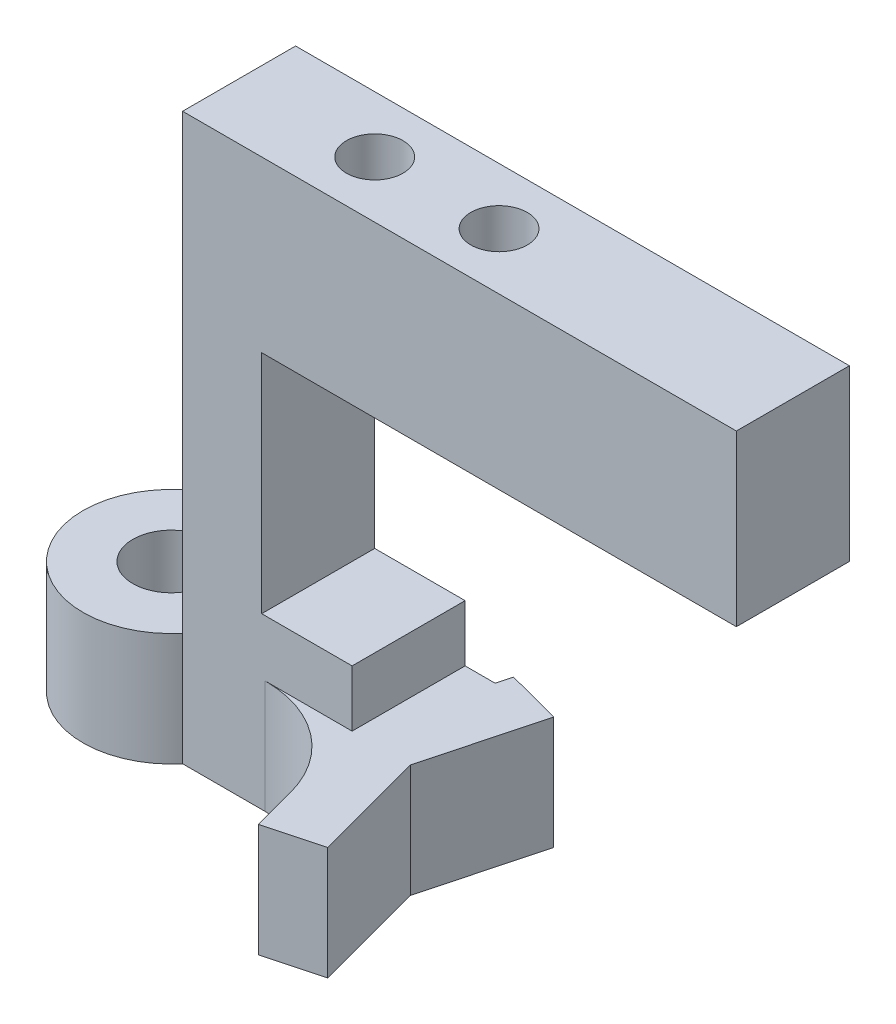
from build123d import *

# Parameters (mm, degrees)
BOSS_EXTRUDE1_DEPTH = 5
BOSS_EXTRUDE2_DEPTH = 10
FILLET1_R           = 10
SKETCH3_W           = 8
SKETCH3_H           = 20
CUT_EXTRUDE1_DEPTH  = 74.171272574
SKETCH4_R           = 2.5
CUT_EXTRUDE2_DEPTH  = 63.379394923
SKETCH5_R           = 3.4
BOSS_EXTRUDE4_DEPTH = 10


with BuildPart() as part:
    # Sketch1 → Boss-Extrude1 (new, symmetric)
    with BuildSketch(Plane.XY):
        Polygon((49, 0), (0, 0), (0, -50), (15, -50), (15, -15), (49, -15), align=None)
    extrude(amount=BOSS_EXTRUDE1_DEPTH, both=True)

    # Sketch2 → Boss-Extrude2 (add)
    with BuildSketch(Plane.XZ.offset(50)):
        Polygon((22.832157544, -5), (18, -6.284621916), (15, 5), (18, 16.284621916), (22.832157544, 15), (20.173672375, 5), align=None)
        Polygon((15, -5), (17.658485169, -5), (15, 5), align=None)
        Polygon((18, 16.284621916), (15, 5), (20.173672375, 5), (22.832157544, 15), align=None)
    extrude(amount=-BOSS_EXTRUDE2_DEPTH)

    # Fillet1
    fillet1_edges = [part.edges().sort_by_distance(p)[0] for p in [
        (15, -45, 5),
    ]]
    fillet(fillet1_edges, radius=FILLET1_R)

    # Sketch3 → Cut-Extrude1 (cut, through all)
    with BuildSketch(Plane(origin=(0, 0, -5), x_dir=(-1, 0, 0), z_dir=(0, 0, -1))):
        with Locations((-11, -25)):
            Rectangle(SKETCH3_W, SKETCH3_H)
    extrude(amount=-CUT_EXTRUDE1_DEPTH, mode=Mode.SUBTRACT)

    # Sketch4 → Cut-Extrude2 (cut, through all)
    with BuildSketch(Plane.XZ.offset(15)):
        with Locations(Location((23, 0, 0), (0, 0, 270))):
            Circle(SKETCH4_R)
        with Locations(Location((12, 0, 0), (0, 0, 270))):
            Circle(SKETCH4_R)
    extrude(amount=-CUT_EXTRUDE2_DEPTH, mode=Mode.SUBTRACT)

    # Sketch5 → Boss-Extrude4 (add)
    with BuildSketch(Plane.XZ.offset(50)):
        with BuildLine():
            Line((0, 5), (0, -5))
            ThreePointArc((0, -5), (-13.810249676, 0), (0, 5))
        make_face()
        with Locations(Location((-6, 0, 0), (0, 0, 270))):
            Circle(SKETCH5_R, mode=Mode.SUBTRACT)
    extrude(amount=-BOSS_EXTRUDE4_DEPTH)


solid = part.part
